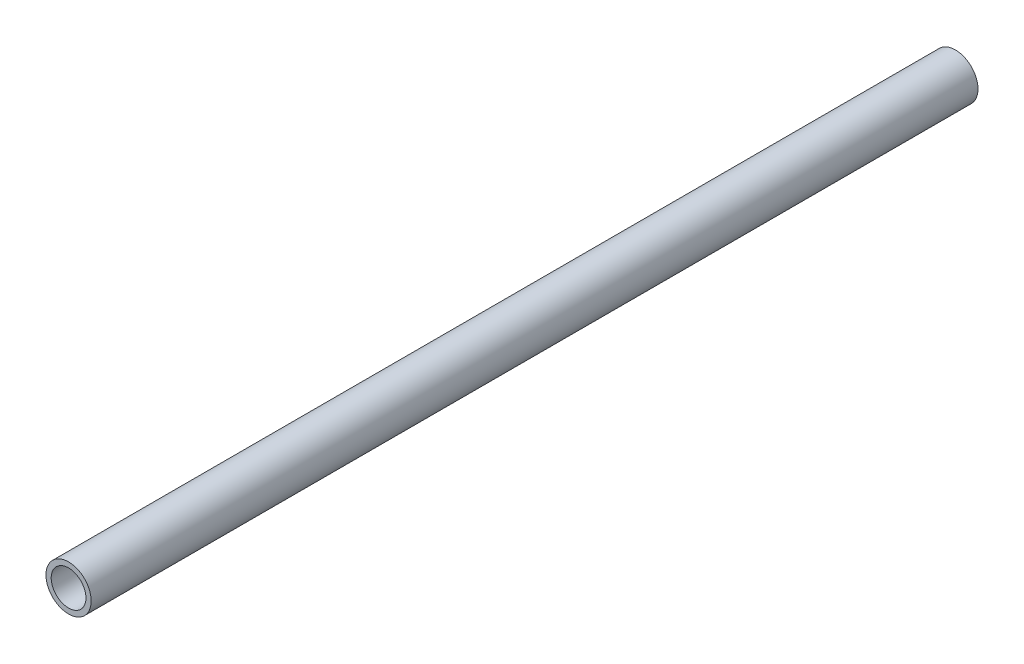
from build123d import *

# Parameters (mm, degrees)
SKETCH1_R           = 16.51
SKETCH1_R_2         = 12.7
BOSS_EXTRUDE1_DEPTH = 647.7


with BuildPart() as part:
    # Sketch1 → Boss-Extrude1 (new body)
    with BuildSketch(Plane.XY):
        Circle(SKETCH1_R)
        Circle(SKETCH1_R_2, mode=Mode.SUBTRACT)
    extrude(amount=BOSS_EXTRUDE1_DEPTH)


solid = part.part
